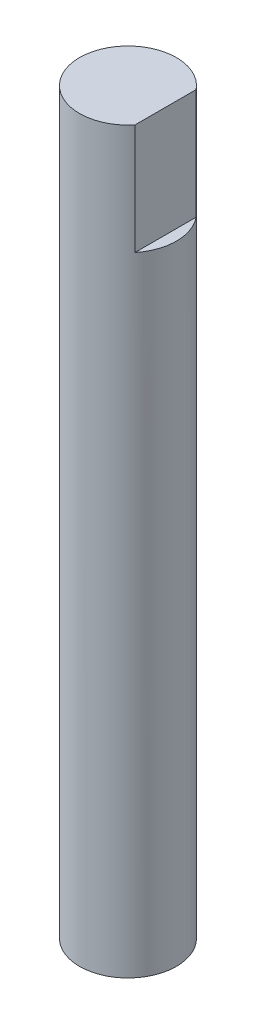
from build123d import *

# Parameters (mm, degrees)
SKETCH1_R           = 2.5
BOSS_EXTRUDE1_DEPTH = 38.1
CUT_EXTRUDE1_START  = -5.7
CUT_EXTRUDE1_DEPTH  = 5.7


with BuildPart() as part:
    # Sketch1 → Boss-Extrude1 (new body)
    with BuildSketch(Plane(origin=(0, 0, 0), x_dir=(1, 0, 0), z_dir=(0, 1, 0))):
        with Locations(Location((0, 0, 0), (0, 0, 90))):
            Circle(SKETCH1_R)
    extrude(amount=BOSS_EXTRUDE1_DEPTH)

    # Sketch2 → Cut-Extrude1 (cut)
    with BuildSketch(Plane(origin=(0, 38.1, 0), x_dir=(1, 0, 0), z_dir=(0, 1, 0)).offset(CUT_EXTRUDE1_START)):
        with BuildLine():
            Line((1.94, 1.576832268), (1.94, -1.576832268))
            ThreePointArc((1.94, -1.576832268), (2.5, 0), (1.94, 1.576832268))
        make_face()
    extrude(amount=CUT_EXTRUDE1_DEPTH, mode=Mode.SUBTRACT)


solid = part.part
